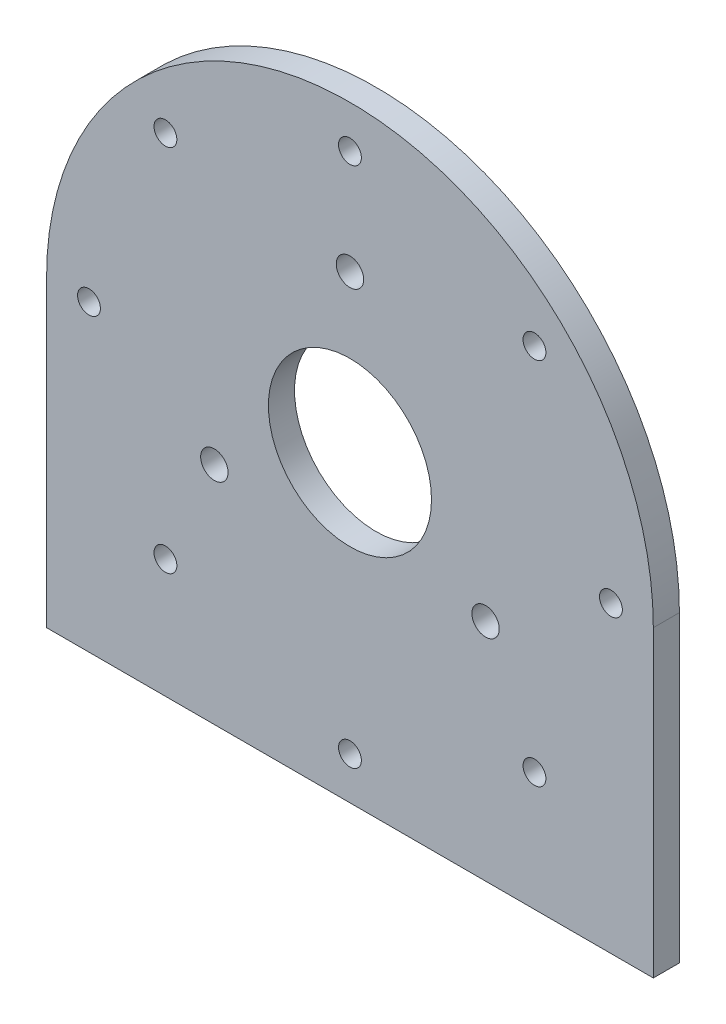
from build123d import *

# Parameters (mm, degrees)
SKETCH1_R           = 2.1
SKETCH1_R_2         = 12.5
SKETCH1_R_3         = 1.75
BOSS_EXTRUDE1_DEPTH = 4


with BuildPart() as part:
    # Sketch1 → Boss-Extrude1 (new body)
    with BuildSketch(Plane.XY):
        with BuildLine():
            Line((-46.5, 0), (-46.5, -46.5))
            Line((-46.5, -46.5), (46.5, -46.5))
            Line((46.5, -46.5), (46.5, 0))
            ThreePointArc((46.5, 0), (0, 46.5), (-46.5, 0))
        make_face()
        with Locations((0, 24)):
            Circle(SKETCH1_R, mode=Mode.SUBTRACT)
        with Locations((-20.784609691, -12)):
            Circle(SKETCH1_R, mode=Mode.SUBTRACT)
        with Locations((20.784609691, -12)):
            Circle(SKETCH1_R, mode=Mode.SUBTRACT)
        Circle(SKETCH1_R_2, mode=Mode.SUBTRACT)
        with Locations((0, 40)):
            Circle(SKETCH1_R_3, mode=Mode.SUBTRACT)
        with Locations((28.284271247, 28.284271247)):
            Circle(SKETCH1_R_3, mode=Mode.SUBTRACT)
        with Locations((40, 0)):
            Circle(SKETCH1_R_3, mode=Mode.SUBTRACT)
        with Locations((28.284271247, -28.284271247)):
            Circle(SKETCH1_R_3, mode=Mode.SUBTRACT)
        with Locations((0, -40)):
            Circle(SKETCH1_R_3, mode=Mode.SUBTRACT)
        with Locations((-28.284271247, -28.284271247)):
            Circle(SKETCH1_R_3, mode=Mode.SUBTRACT)
        with Locations((-40, 0)):
            Circle(SKETCH1_R_3, mode=Mode.SUBTRACT)
        with Locations((-28.284271247, 28.284271247)):
            Circle(SKETCH1_R_3, mode=Mode.SUBTRACT)
    extrude(amount=BOSS_EXTRUDE1_DEPTH)


solid = part.part
